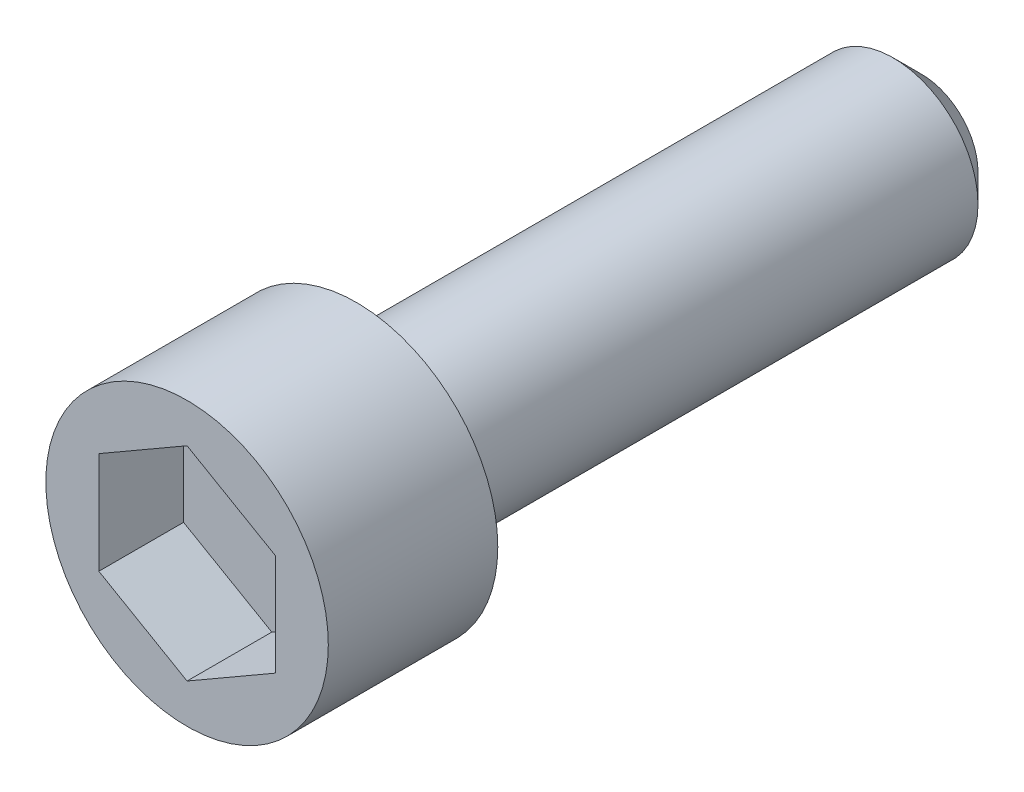
from build123d import *

# Parameters (mm, degrees)
SKETCH_1_R          = 1.5
EXTRUDE_1_DEPTH     = 10
SKETCH_2_R          = 2.5
EXTRUDE_2_DEPTH     = 3
CUT_EXTRUDE_1_DEPTH = 1.5
CHAMFER_1_SIZE      = 0.5


with BuildPart() as part:
    # 草图1 → 凸台-拉伸1 (new body)
    with BuildSketch(Plane.XY):
        Circle(SKETCH_1_R)
    extrude(amount=EXTRUDE_1_DEPTH)

    # 草图2 → 凸台-拉伸2 (add)
    with BuildSketch(Plane.XY.offset(10)):
        Circle(SKETCH_2_R)
    extrude(amount=EXTRUDE_2_DEPTH)

    # 草图3 → 切除-拉伸1 (cut)
    with BuildSketch(Plane.XY.offset(13)):
        Polygon((0, 1.803382283), (-1.56177487, 0.901691141), (-1.56177487, -0.901691141), (0, -1.803382283), (1.56177487, -0.901691141), (1.56177487, 0.901691141), align=None)
    extrude(amount=-CUT_EXTRUDE_1_DEPTH, mode=Mode.SUBTRACT)

    # 倒角1
    chamfer_1_edges = [part.edges().sort_by_distance(p)[0] for p in [
        (-1.5, 0, 0),
    ]]
    chamfer(chamfer_1_edges, length=CHAMFER_1_SIZE)


solid = part.part
